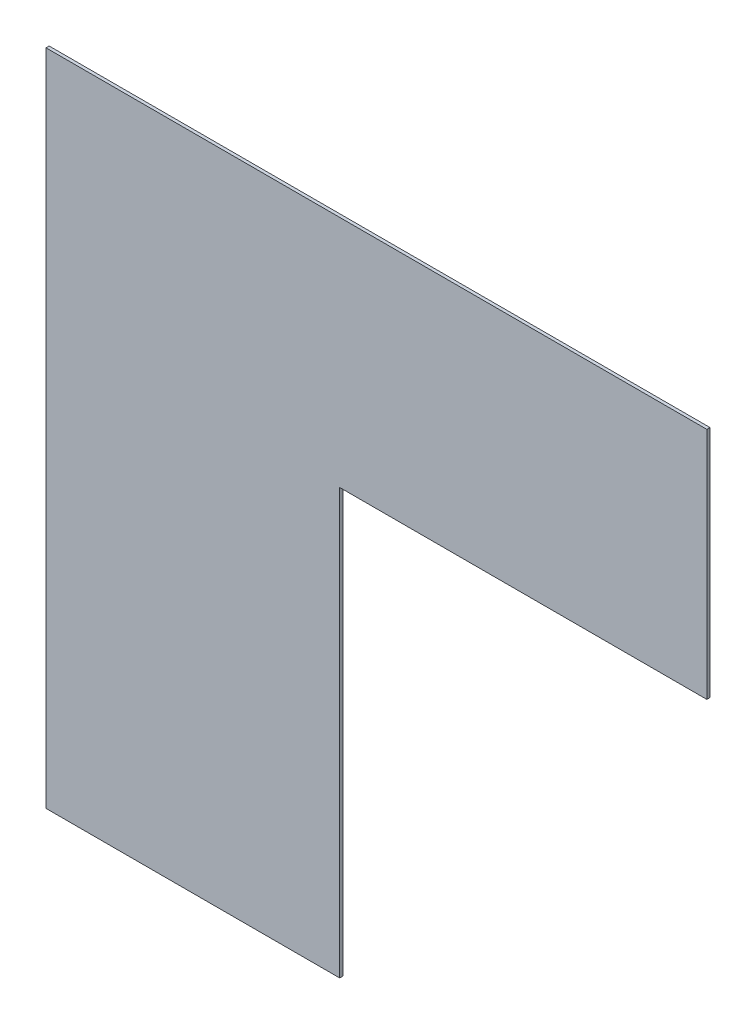
from build123d import *

# Parameters (mm, degrees)
BOSS_EXTRU_1_DEPTH = 3


with BuildPart() as part:
    # Esquisse1 → Boss.-Extru.1 (new body)
    with BuildSketch(Plane.XY):
        Polygon((350, 628), (-280, 628), (-280, 0), (0, 0), (0, 405), (350, 405), align=None)
    extrude(amount=BOSS_EXTRU_1_DEPTH)


solid = part.part
